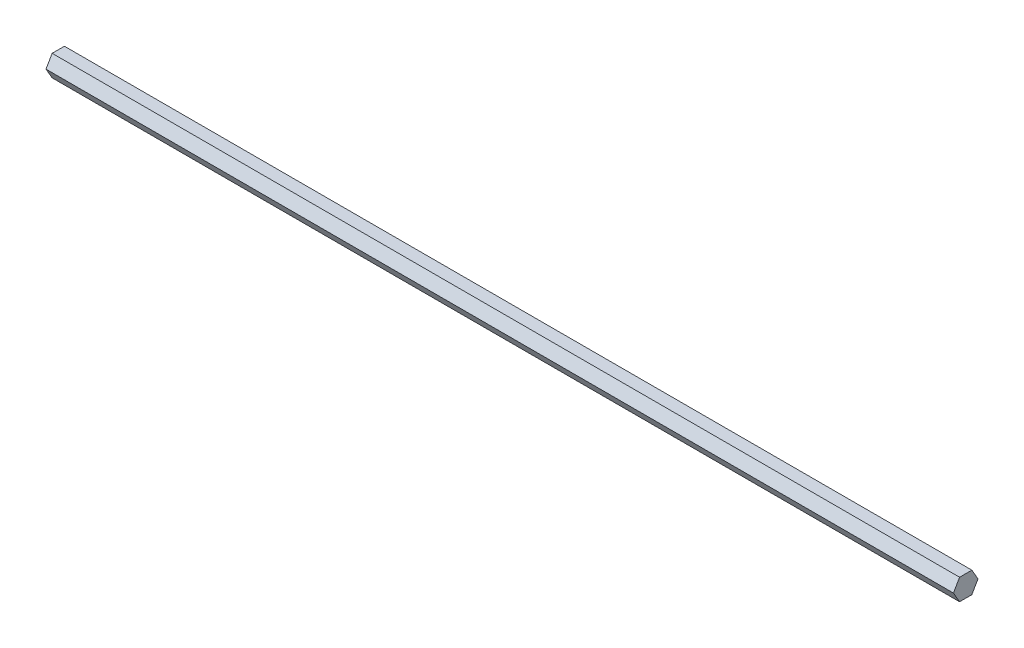
from build123d import *

# Parameters (mm, degrees)
BOSS_EXTRUDE1_DEPTH         = 203.2
F_1_4_20_TAPPED_HOLE1_D     = 5.1054
F_1_4_20_TAPPED_HOLE1_DEPTH = 19.05
F_1_4_20_TAPPED_HOLE1_TIP   = 1.533816902


with BuildPart() as part:
    # Sketch1 → Boss-Extrude1 (new, symmetric)
    with BuildSketch(Plane(origin=(0, 0, 0), x_dir=(0, 0, -1), z_dir=(1, 0, 0))):
        Polygon((5.499261314, 0), (2.749630657, 4.7625), (-2.749630657, 4.7625), (-5.499261314, 0), (-2.749630657, -4.7625), (2.749630657, -4.7625), align=None)
    extrude(amount=BOSS_EXTRUDE1_DEPTH, both=True)

    # 1/4-20 Tapped Hole1
    with Locations(Plane.ZY.offset(203.2)):
        with Locations((0, 0)):
            Hole(F_1_4_20_TAPPED_HOLE1_D / 2, depth=F_1_4_20_TAPPED_HOLE1_DEPTH)
            with Locations((0, 0, -(F_1_4_20_TAPPED_HOLE1_DEPTH + F_1_4_20_TAPPED_HOLE1_TIP / 2))):  # 118° drill point
                Cone(0, F_1_4_20_TAPPED_HOLE1_D / 2, F_1_4_20_TAPPED_HOLE1_TIP, mode=Mode.SUBTRACT)


solid = part.part
